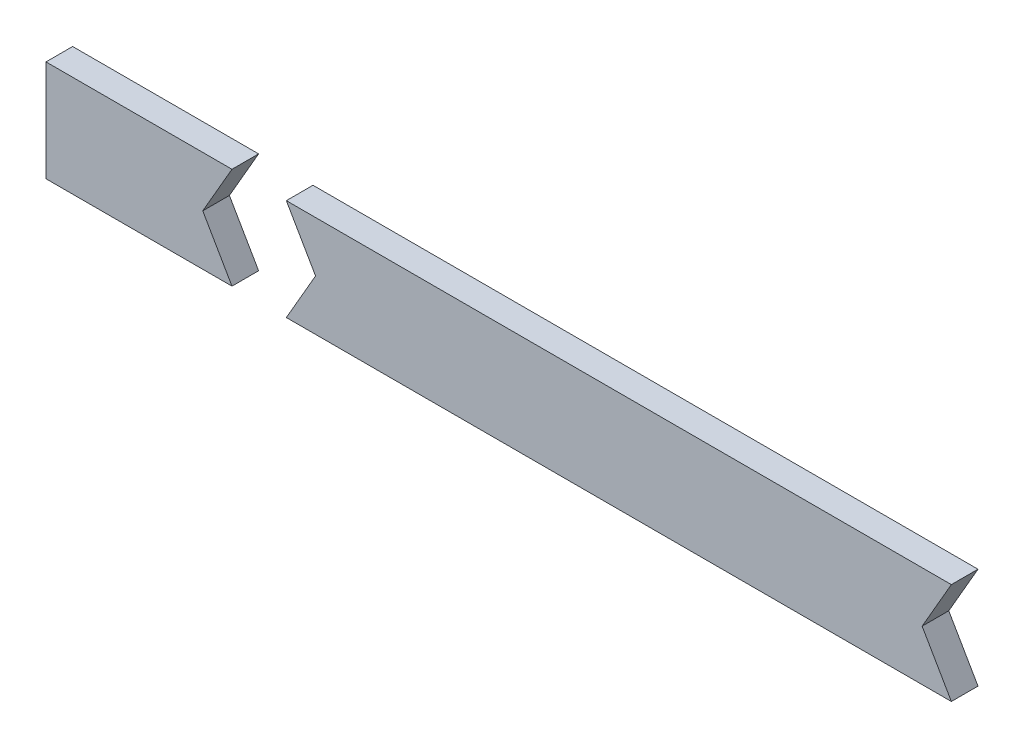
from build123d import *

# Parameters (mm, degrees)
BOSS_EXTRUDE1_DEPTH = 1.5
BOSS_EXTRUDE2_DEPTH = 1.5


with BuildPart() as part:
    # Sketch2 → Boss-Extrude1 (new body)
    with BuildSketch(Plane.XY):
        Polygon((0, 2.85), (0, -2.85), (10.470021787, -2.85), (8.824573519, 0), (10.470021787, 2.85), align=None)
    extrude(amount=BOSS_EXTRUDE1_DEPTH)


with BuildPart() as body_2:
    # Sketch3 → Boss-Extrude2 (new body)
    with BuildSketch(Plane.XY):
        Polygon((13.529978213, 2.85), (15.175426481, 0), (13.529978213, -2.85), (50.970021787, -2.85), (49.324573519, 0), (50.970021787, 2.85), align=None)
    extrude(amount=BOSS_EXTRUDE2_DEPTH)


solid = Compound([part.part, body_2.part])
